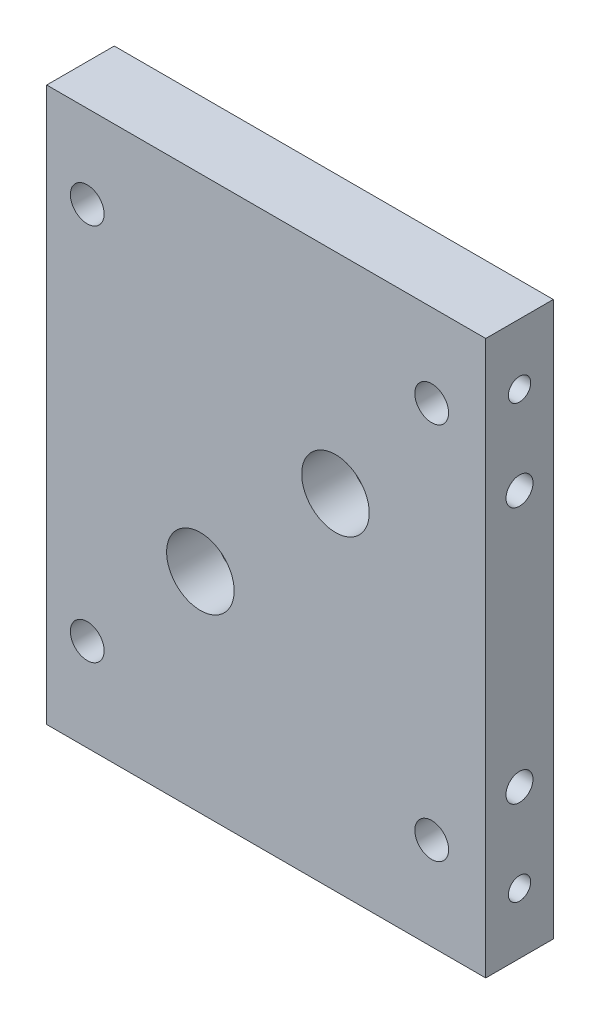
from build123d import *

# Parameters (mm, degrees)
ESQUISSE1_W                                        = 65
ESQUISSE1_H                                        = 82
BOSS_EXTRU_1_DEPTH                                 = 10
CHAMBRAGE_POUR_VIS_T_TE_HEXAGONALE_M51_D           = 5.5
CHAMBRAGE_POUR_VIS_T_TE_HEXAGONALE_M51_CBORE_D     = 10
CHAMBRAGE_POUR_VIS_T_TE_HEXAGONALE_M51_CBORE_DEPTH = 7
TROU_TARAUD_M42_D                                  = 3.3
TROU_TARAUD_M42_DEPTH                              = 11.5
TROU_TARAUD_M42_TIP                                = 0.991420021
TROUS_DE_CENTRAGE_4_0MMTRANSITIONAL_1_D            = 4
TROUS_DE_CENTRAGE_4_0MMTRANSITIONAL_1_DEPTH        = 8
TROUS_DE_CENTRAGE_4_0MMTRANSITIONAL_1_TIP          = 1.154700538
TROU_TARAUD_M61_D                                  = 5


with BuildPart() as part:
    # Esquisse1 → Boss.-Extru.1 (new body)
    with BuildSketch(Plane.XY):
        Rectangle(ESQUISSE1_W, ESQUISSE1_H)
    extrude(amount=BOSS_EXTRU_1_DEPTH)

    # Chambrage pour vis à tête hexagonale M51 (through all)
    with Locations(Plane.XY.offset(10)):
        with Locations((10.25, 10), (-9.75, -10)):
            CounterBoreHole(CHAMBRAGE_POUR_VIS_T_TE_HEXAGONALE_M51_D / 2, CHAMBRAGE_POUR_VIS_T_TE_HEXAGONALE_M51_CBORE_D / 2, CHAMBRAGE_POUR_VIS_T_TE_HEXAGONALE_M51_CBORE_DEPTH)

    # Trou taraudé M42
    with Locations(Plane(origin=(32.5, 0, 0), x_dir=(0, 0, -1), z_dir=(1, 0, 0))):
        with Locations((-5, -32), (-5, 32)):
            Hole(TROU_TARAUD_M42_D / 2, depth=TROU_TARAUD_M42_DEPTH)
            with Locations((0, 0, -(TROU_TARAUD_M42_DEPTH + TROU_TARAUD_M42_TIP / 2))):  # 118° drill point
                Cone(0, TROU_TARAUD_M42_D / 2, TROU_TARAUD_M42_TIP, mode=Mode.SUBTRACT)

    # Trous de centrage Ø4.0mmTransitional 1
    with Locations(Plane(origin=(32.5, 0, 0), x_dir=(0, 0, -1), z_dir=(1, 0, 0))):
        with Locations((-5, -19), (-5, 19)):
            Hole(TROUS_DE_CENTRAGE_4_0MMTRANSITIONAL_1_D / 2, depth=TROUS_DE_CENTRAGE_4_0MMTRANSITIONAL_1_DEPTH)
            with Locations((0, 0, -(TROUS_DE_CENTRAGE_4_0MMTRANSITIONAL_1_DEPTH + TROUS_DE_CENTRAGE_4_0MMTRANSITIONAL_1_TIP / 2))):  # 120° drill point
                Cone(0, TROUS_DE_CENTRAGE_4_0MMTRANSITIONAL_1_D / 2, TROUS_DE_CENTRAGE_4_0MMTRANSITIONAL_1_TIP, mode=Mode.SUBTRACT)

    # Trou taraudé M61 (through all)
    with Locations(Plane(origin=(0, 0, 0), x_dir=(-1, 0, 0), z_dir=(0, 0, -1))):
        with Locations((26.5, 28.7), (-24.5, 28.7), (-24.5, -27.3), (26.5, -27.3)):
            Hole(TROU_TARAUD_M61_D / 2)


solid = part.part
